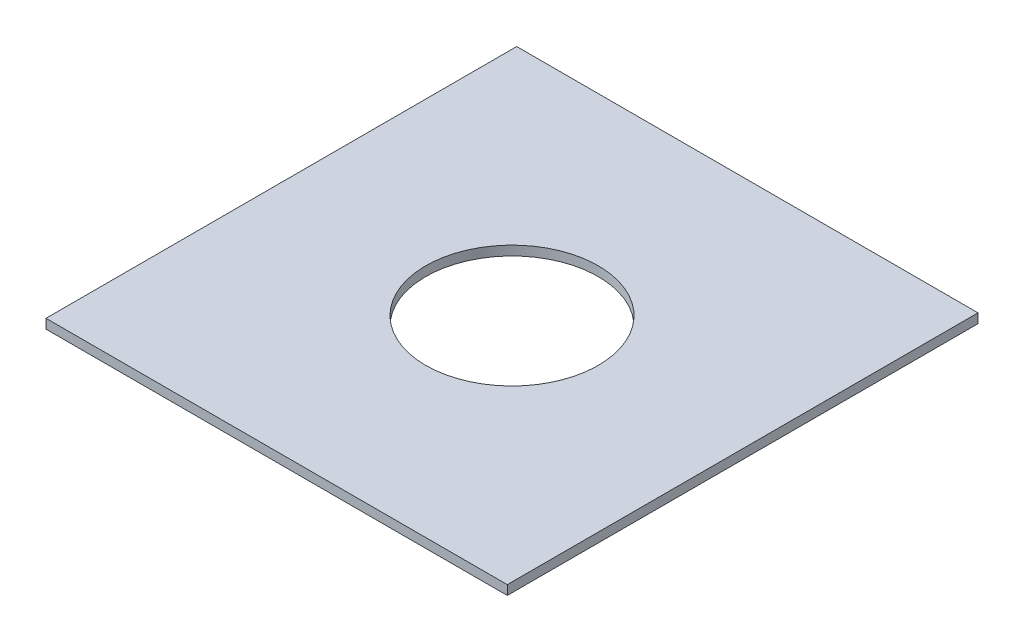
from build123d import *

# Parameters (mm, degrees)
SKETCH1_W           = 294
SKETCH1_H           = 300
SKETCH1_R           = 55
BOSS_EXTRUDE1_DEPTH = 6


with BuildPart() as part:
    # Sketch1 → Boss-Extrude1 (new body)
    with BuildSketch(Plane(origin=(0, 0, 0), x_dir=(1, 0, 0), z_dir=(0, 1, 0))):
        Rectangle(SKETCH1_W, SKETCH1_H)
        with Locations(Location((0, 0, 0), (0, 0, 270))):
            Circle(SKETCH1_R, mode=Mode.SUBTRACT)
    extrude(amount=BOSS_EXTRUDE1_DEPTH)


solid = part.part
